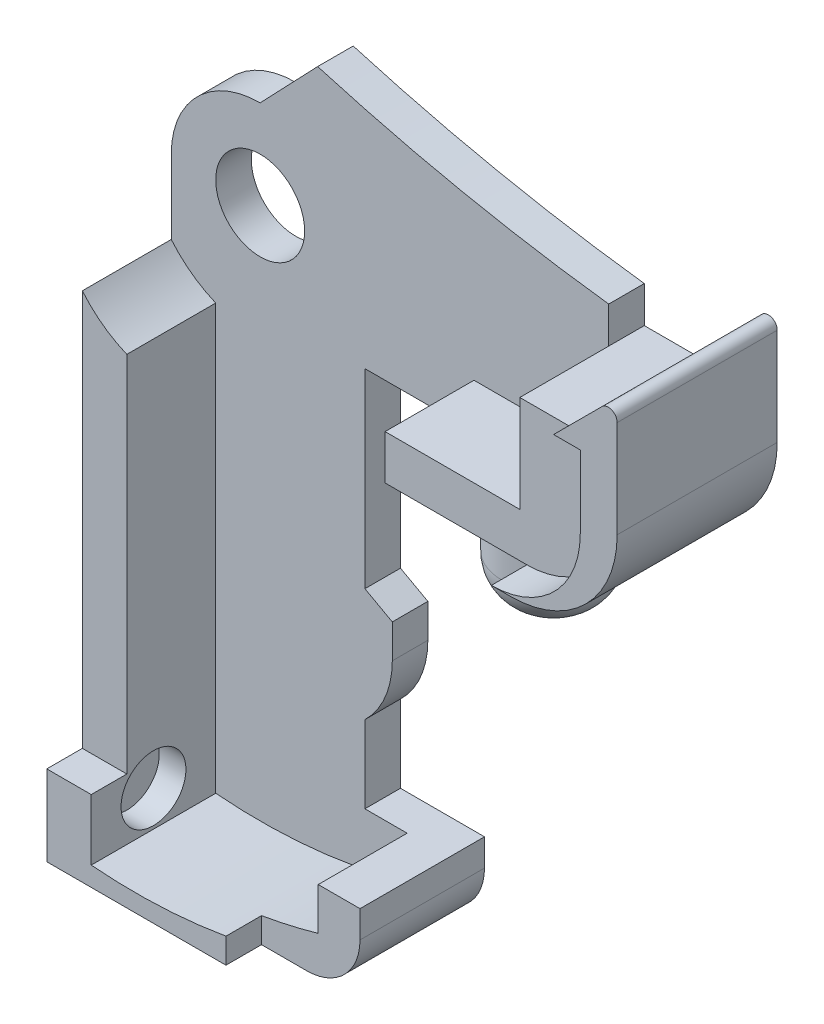
from build123d import *

# Parameters (mm, degrees)
EXTRUDE_3_DEPTH     = 9
EXTRUDE_3_2_DEPTH   = 9
EXTRUDE_4_DEPTH     = 7
SKETCH_1_8_R        = 2.5
EXTRUDE_5_DEPTH     = 2
SKETCH_2_R          = 2.9
EXTRUDE_6_DEPTH     = 2.45
SKETCH_4_R          = 2.9
EXTRUDE_7_DEPTH     = 2
FILLET_2_R          = 2.4
SKETCH_5_R          = 1.825
CUT_EXTRUDE_1_DEPTH = 1.5


with BuildPart() as part:
    # 스케치1 → 보스-돌출3 (new body)
    with BuildSketch(Plane.XY):
        with BuildLine():
            Line((-2.5, -26.437677825), (-5, -26.437677825))
            Line((-5, -26.437677825), (-5, -30.96175738))
            Line((-5, -30.96175738), (5.076141326, -30.96175738))
            Line((5.076141326, -30.96175738), (5.076141326, -29.54601506))
            ThreePointArc((5.076141326, -29.54601506), (1.298498135, -29.950761581), (-2.5, -29.874474333))
            Line((-2.5, -29.874474333), (-2.5, -26.437677825))
        make_face()
    extrude(amount=EXTRUDE_3_DEPTH)

    # 스케치1<7> → 보스-돌출4 (add)
    with BuildSketch(Plane.XY):
        with BuildLine():
            Line((23.5, 2.950728465), (19.6, 2.950728465))
            Line((19.6, 2.950728465), (19.6, -2.5))
            Line((19.6, -2.5), (12.023157318, -2.5))
            Line((12.023157318, -2.5), (12.023157318, -5))
            Line((12.023157318, -5), (20, -5))
            ThreePointArc((20, -5), (23.535533906, -3.535533906), (25, 0))
            Line((25, 0), (25, 4.09591659))
            Line((25, 4.09591659), (23.5, 4.09591659))
            Line((23.5, 4.09591659), (23.5, 2.950728465))
        make_face()
        with BuildLine():
            ThreePointArc((-2.5, -6), (-3.862002616, -5.228282299), (-5, -4.153311931))
            Line((-5, -4.153311931), (-5, -26.437677825))
            Line((-5, -26.437677825), (-2.5, -26.437677825))
            Line((-2.5, -26.437677825), (-2.5, -6))
        make_face()
        with BuildLine():
            Line((5.076141326, -29.54601506), (5.076141326, -30.96175738))
            Line((5.076141326, -30.96175738), (7.613716386, -30.96175738))
            ThreePointArc((7.613716386, -30.96175738), (9.735036729, -30.083077723), (10.613716386, -27.96175738))
            Line((10.613716386, -27.96175738), (10.613716386, -26.437579436))
            Line((10.613716386, -26.437579436), (8.264928228, -26.437579436))
            Line((8.264928228, -26.437579436), (8.264928228, -28.81709871))
            ThreePointArc((8.264928228, -28.81709871), (6.680483813, -29.225080884), (5.076141326, -29.54601506))
        make_face()
    extrude(amount=EXTRUDE_4_DEPTH)


with BuildPart() as body_2:
    # 스케치1 → Extrude 3 2 (new body)
    with BuildSketch(Plane.XY):
        with BuildLine():
            Line((26.22215467, 6.81807126), (23.5, 4.09591659))
            Line((23.5, 4.09591659), (25, 4.09591659))
            Line((25, 4.09591659), (25, 0))
            ThreePointArc((25, 0), (23.535533906, -3.535533906), (20, -5))
            Line((20, -5), (21.075708061, -5))
            ThreePointArc((21.075708061, -5), (25.318348748, -3.242640687), (27.075708061, 1))
            Line((27.075708061, 1), (27.075708061, 6.46451787))
            ThreePointArc((27.075708061, 6.46451787), (26.767049777, 6.926457636), (26.22215467, 6.81807126))
        make_face()
    extrude(amount=EXTRUDE_3_2_DEPTH)


with BuildPart() as extrude_4_piece_1:
    # of the separate pieces the step leaves, piece 1, a body of its own (extrude_4_pieces)
    add(part.part.solids().sort_by_distance((-2.5, -29.874474333, 0))[0])



with BuildPart() as extrude_4_piece_2:
    # of the separate pieces the step leaves, piece 2, a body of its own (extrude_4_pieces)
    add(part.part.solids().sort_by_distance((23.5, 2.950728465, 0))[0])


with BuildPart() as extrude_4_piece_1_1:
    add(extrude_4_piece_1.part)

    add(extrude_4_piece_2.part)  # 보스-돌출5 merges 보스-돌출4 piece 2
    # 스케치1<8> → 보스-돌출5 (add)
    with BuildSketch(Plane.XY):
        with BuildLine():
            Line((3.231912185, 8.38327913), (0, 5))
            ThreePointArc((0, 5), (-3.535533906, 3.535533906), (-5, 0))
            Line((-5, 0), (-5, -4.153311931))
            ThreePointArc((-5, -4.153311931), (-3.862002616, -5.228282299), (-2.5, -6))
            Line((-2.5, -6), (-2.5, -29.874474333))
            ThreePointArc((-2.5, -29.874474333), (2.93054776, -29.83531643), (8.264928228, -28.81709871))
            Line((8.264928228, -28.81709871), (8.264928228, -26.437579436))
            Line((8.264928228, -26.437579436), (5.889404941, -26.437579436))
            Line((5.889404941, -26.437579436), (5.889404941, -22.090836604))
            ThreePointArc((5.889404941, -22.090836604), (7.029116149, -20.43207672), (7.430270561, -18.459894902))
            Line((7.430270561, -18.459894902), (7.430270561, -16.564445668))
            Line((7.430270561, -16.564445668), (5.889404941, -15.718789718))
            Line((5.889404941, -15.718789718), (5.889404941, -5))
            Line((5.889404941, -5), (12.023157318, -5))
            Line((12.023157318, -5), (12.023157318, -2.5))
            Line((12.023157318, -2.5), (19.6, -2.5))
            Line((19.6, -2.5), (19.6, 5))
            ThreePointArc((19.6, 5), (11.347380216, 6.359873864), (3.231912185, 8.38327913))
        make_face()
        Circle(SKETCH_1_8_R, mode=Mode.SUBTRACT)
    extrude(amount=EXTRUDE_5_DEPTH)

    # 스케치2 → 보스-돌출6 (add, symmetric)
    with BuildSketch(Plane.XZ.offset(5)):
        with Locations((18, 3.5)):
            Circle(SKETCH_2_R)
    extrude(amount=EXTRUDE_6_DEPTH, both=True)

    # 스케치4 → 보스-돌출7 (add)
    with BuildSketch(Plane.XZ.offset(7.45)):
        with Locations((18, 3.5)):
            Circle(SKETCH_4_R)
    extrude(amount=EXTRUDE_7_DEPTH)

    # 필렛2
    fillet_2_edges = [extrude_4_piece_1_1.edges().sort_by_distance(p)[0] for p in [
        (15.1, -9.45, 3.5),
    ]]
    fillet(fillet_2_edges, radius=FILLET_2_R)

    # 스케치5 → 컷-돌출1 (cut)
    with BuildSketch(Plane(origin=(-2.5, 0, 0), x_dir=(0, 0, -1), z_dir=(1, 0, 0))):
        with Locations((-5.5, -27.874474333)):
            Circle(SKETCH_5_R)
    extrude(amount=-CUT_EXTRUDE_1_DEPTH, mode=Mode.SUBTRACT)


solid = Compound([body_2.part, extrude_4_piece_1_1.part])
